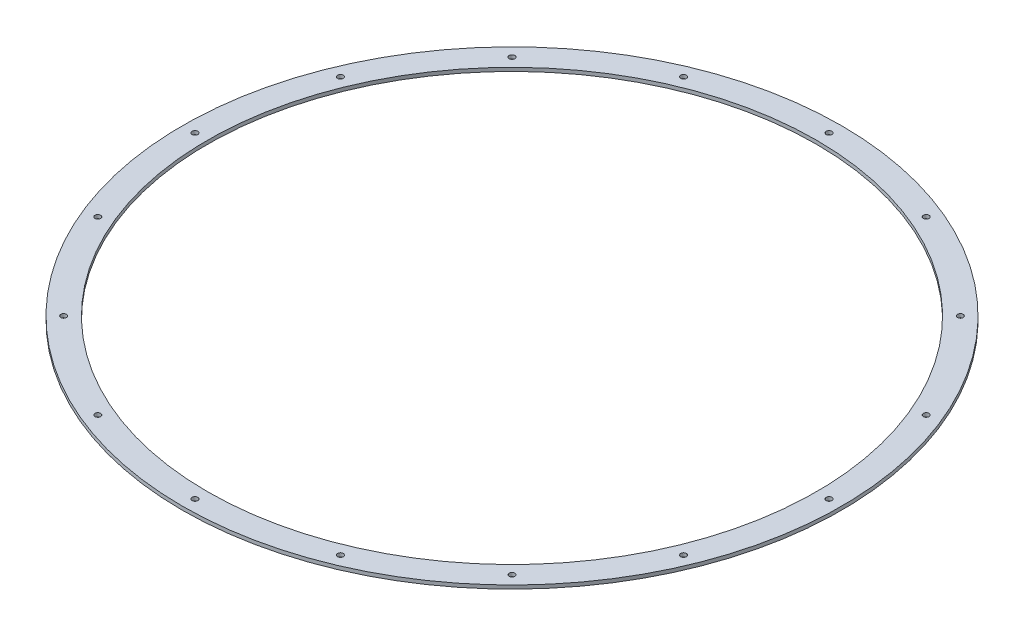
from build123d import *

# Parameters (mm, degrees)
SKETCH1_R           = 460
SKETCH1_R_2         = 425
BOSS_EXTRUDE1_DEPTH = 5
SKETCH2_R           = 4
CUT_EXTRUDE1_DEPTH  = 10
CIRPATTERN1_COUNT   = 16


with BuildPart() as part:
    # Sketch1 → Boss-Extrude1 (new body)
    with BuildSketch(Plane(origin=(0, 0, 0), x_dir=(1, 0, 0), z_dir=(0, 1, 0))):
        with Locations(Location((0, 0, 0), (0, 0, 270))):
            Circle(SKETCH1_R)
        with Locations(Location((0, 0, 0), (0, 0, 270))):
            Circle(SKETCH1_R_2, mode=Mode.SUBTRACT)
    extrude(amount=BOSS_EXTRUDE1_DEPTH)

    # Sketch2 → Cut-Extrude1 (cut)
    with BuildSketch(Plane(origin=(0, 5, 0), x_dir=(1, 0, 0), z_dir=(0, 1, 0))):
        with Locations(Location((0, 442.5, 0), (0, 0, 270))):
            Circle(SKETCH2_R)
    cut_extrude1 = extrude(amount=-CUT_EXTRUDE1_DEPTH, mode=Mode.SUBTRACT)

    # CirPattern1: Cut-Extrude1 ×16 about axis
    cirpattern1_axis = Axis((0, 0, 0), (0, 1, 0))
    for i in range(1, CIRPATTERN1_COUNT):
        add(cut_extrude1.rotate(cirpattern1_axis, i * 360 / CIRPATTERN1_COUNT), mode=Mode.SUBTRACT)


solid = part.part
